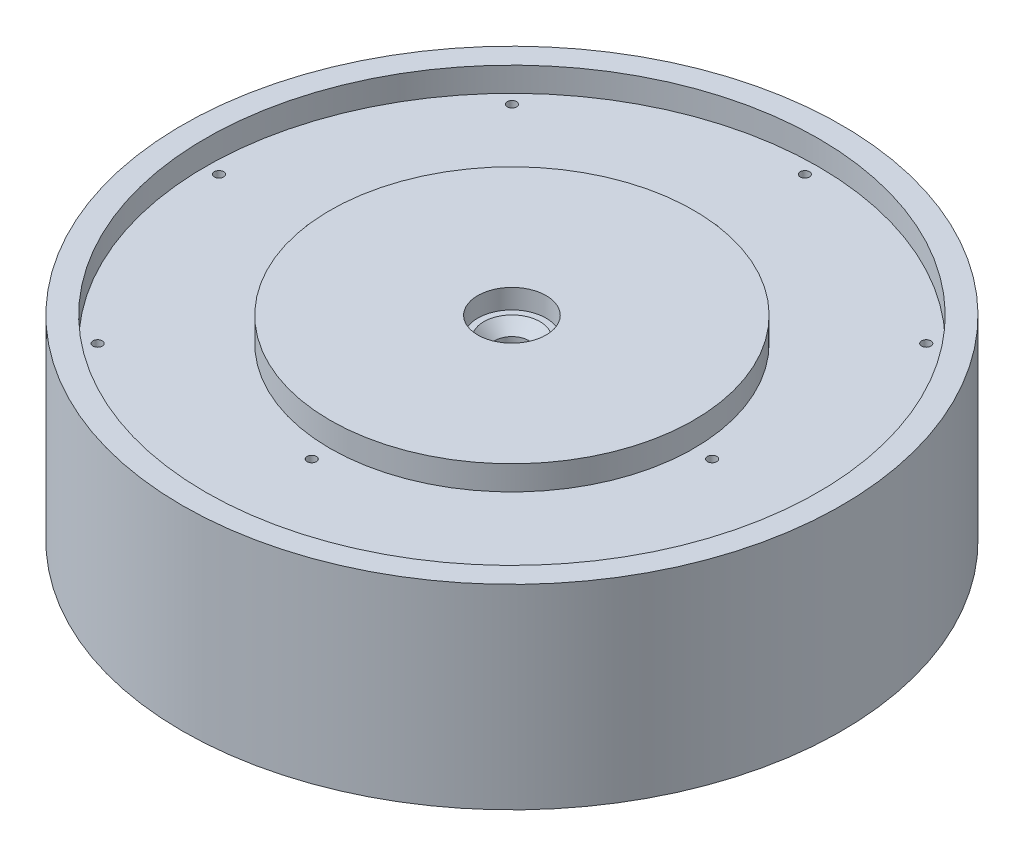
from build123d import *

# Parameters (mm, degrees)
SKETCH1_R           = 135
SKETCH1_R_2         = 7
BOSS_EXTRUDE1_DEPTH = 40
SKETCH2_R           = 14
CUT_EXTRUDE1_DEPTH  = 8
CUT_EXTRUDE2_START  = -72
SKETCH2_3_R         = 14
CUT_EXTRUDE2_DEPTH  = 8
CHAMFER1_SIZE       = 4.5
SKETCH3_W           = 51
SKETCH3_H           = 10
CUT_EXTRUDE3_START  = 30
SKETCH1_3_R         = 1.9
CUT_EXTRUDE3_DEPTH  = 20


with BuildPart() as part:
    # Sketch1 → Boss-Extrude1 (new, symmetric)
    with BuildSketch(Plane(origin=(0, 0, 0), x_dir=(1, 0, 0), z_dir=(0, 1, 0))):
        with Locations(Location((0, 0, 0), (0, 0, 270))):
            Circle(SKETCH1_R)
        with Locations(Location((0, 0, 0), (0, 0, 270))):
            Circle(SKETCH1_R_2, mode=Mode.SUBTRACT)
    extrude(amount=BOSS_EXTRUDE1_DEPTH, both=True)

    # Sketch2 → Cut-Extrude1 (cut)
    with BuildSketch(Plane(origin=(0, 40, 0), x_dir=(1, 0, 0), z_dir=(0, 1, 0))):
        with Locations(Location((0, 0, 0), (0, 0, 270))):
            Circle(SKETCH2_R)
    extrude(amount=-CUT_EXTRUDE1_DEPTH, mode=Mode.SUBTRACT)

    # Sketch2<3> → Cut-Extrude2 (cut)
    with BuildSketch(Plane(origin=(0, 40, 0), x_dir=(1, 0, 0), z_dir=(0, 1, 0)).offset(CUT_EXTRUDE2_START)):
        with Locations(Location((0, 0, 0), (0, 0, 270))):
            Circle(SKETCH2_3_R)
    extrude(amount=-CUT_EXTRUDE2_DEPTH, mode=Mode.SUBTRACT)

    # Chamfer1
    chamfer1_edges = [part.edges().sort_by_distance(p)[0] for p in [
        (0, 32, -7),
        (0, -32, -7),
    ]]
    chamfer(chamfer1_edges, length=CHAMFER1_SIZE)

    # Sketch3 → Cut-Revolve1 (revolve, cut)
    with BuildSketch(Plane(origin=(0, 0, 0), x_dir=(0, 0, -1), z_dir=(1, 0, 0))):
        with Locations((-100, 35)):
            Rectangle(SKETCH3_W, SKETCH3_H)
        with Locations((-100, -35)):
            Rectangle(SKETCH3_W, SKETCH3_H)
    revolve(axis=Axis((0, 58.925226038, 0), (0, -1, 0)), mode=Mode.SUBTRACT)

    # Sketch1<3> → Cut-Extrude3 (cut)
    with BuildSketch(Plane(origin=(0, 0, 0), x_dir=(1, 0, 0), z_dir=(0, 1, 0)).offset(CUT_EXTRUDE3_START)):
        with Locations(Location((0, 120, 0), (0, 0, 90))):
            Circle(SKETCH1_3_R)
        with Locations(Location((84.852813742, 84.852813742, 0), (0, 0, 90))):
            Circle(SKETCH1_3_R)
        with Locations(Location((120, 0, 0), (0, 0, 90))):
            Circle(SKETCH1_3_R)
        with Locations(Location((84.852813742, -84.852813742, 0), (0, 0, 90))):
            Circle(SKETCH1_3_R)
        with Locations(Location((0, -120, 0), (0, 0, 90))):
            Circle(SKETCH1_3_R)
        with Locations(Location((-84.852813742, -84.852813742, 0), (0, 0, 90))):
            Circle(SKETCH1_3_R)
        with Locations(Location((-120, 0, 0), (0, 0, 90))):
            Circle(SKETCH1_3_R)
        with Locations(Location((-84.852813742, 84.852813742, 0), (0, 0, 90))):
            Circle(SKETCH1_3_R)
        with Locations(Location((0, 82, 0), (0, 0, 90))):
            Circle(SKETCH1_3_R)
        with Locations(Location((82, 0, 0), (0, 0, 90))):
            Circle(SKETCH1_3_R)
        with Locations(Location((0, -82, 0), (0, 0, 90))):
            Circle(SKETCH1_3_R)
        with Locations(Location((-82, 0, 0), (0, 0, 90))):
            Circle(SKETCH1_3_R)
    cut_extrude3 = extrude(amount=-CUT_EXTRUDE3_DEPTH, mode=Mode.SUBTRACT)

    # Mirror1: Cut-Extrude3 across plane
    add(cut_extrude3.mirror(Plane.ZX), mode=Mode.SUBTRACT)


solid = part.part
